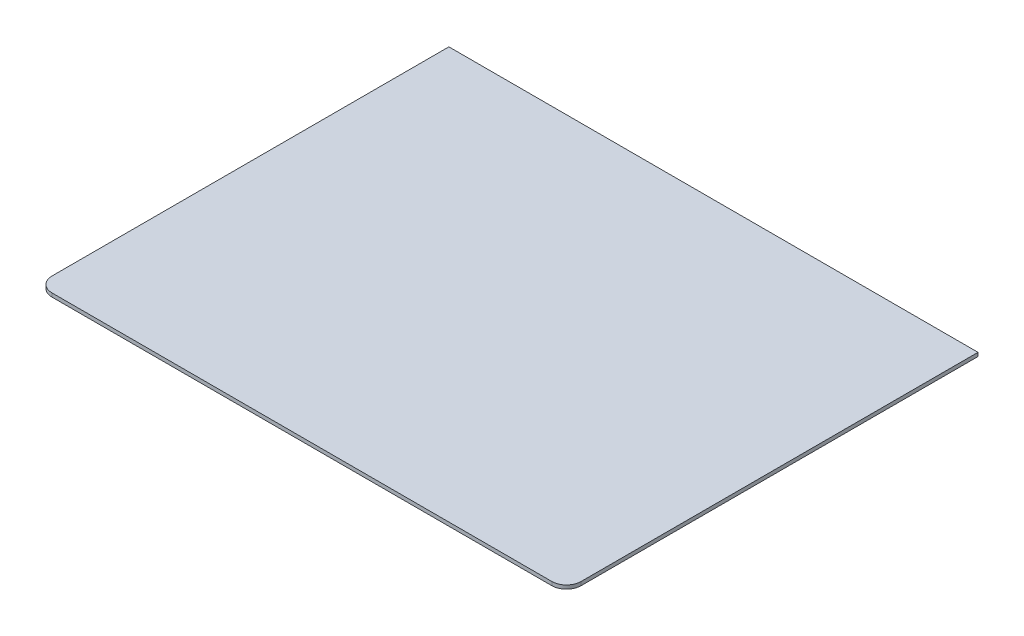
from build123d import *

# Parameters (mm, degrees)
SKETCH2_W           = 457.2
SKETCH2_H           = 355.6
BOSS_EXTRUDE1_DEPTH = 3.175
FILLET1_R           = 12.7


with BuildPart() as part:
    # Sketch2 → Boss-Extrude1 (new body)
    with BuildSketch(Plane(origin=(0, 0, 0), x_dir=(1, 0, 0), z_dir=(0, 1, 0))):
        Rectangle(SKETCH2_W, SKETCH2_H)
    extrude(amount=BOSS_EXTRUDE1_DEPTH)

    # Fillet1
    fillet1_edges = [part.edges().sort_by_distance(p)[0] for p in [
        (228.6, 1.5875, 177.8),
        (-228.6, 1.5875, 177.8),
    ]]
    fillet(fillet1_edges, radius=FILLET1_R)


solid = part.part
